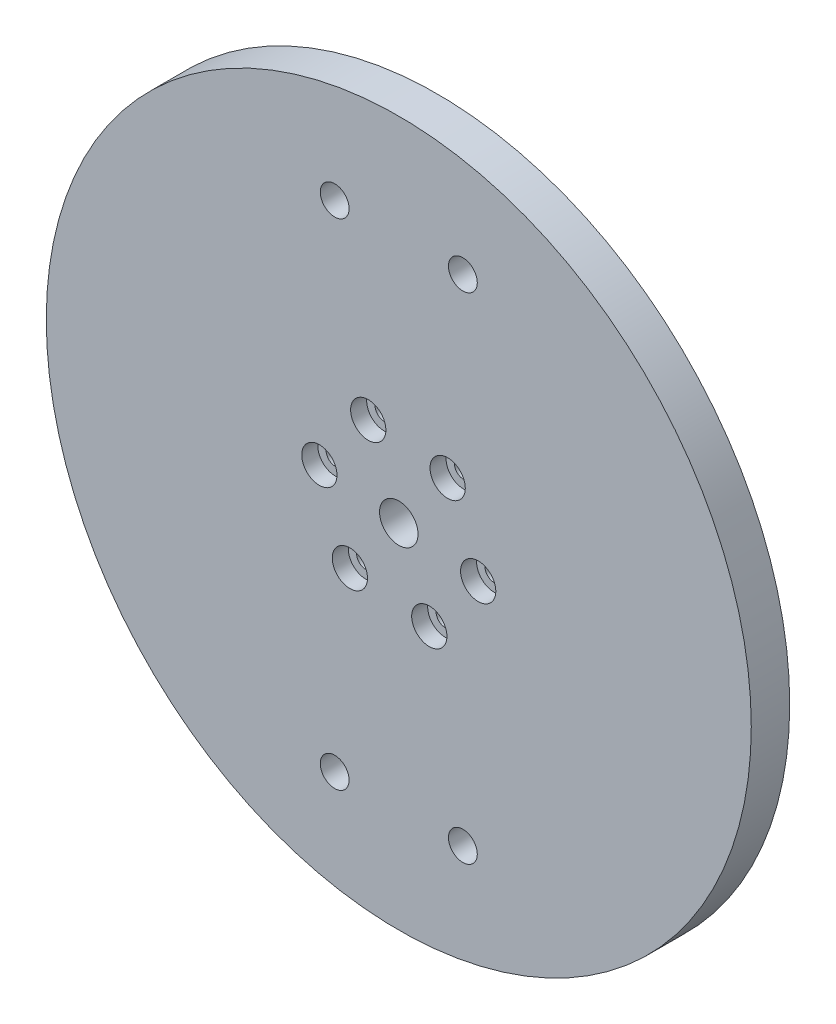
from build123d import *

# Parameters (mm, degrees)
DISCO_START                  = 420
SK_DISCO_R                   = 55
DISCO_DEPTH                  = 6
PASANTES_M2_5_ROTOR_J4_START = 420
SK_PASANTES_M2_5_ROTOR_J4_R  = 1.45
PASANTES_M2_5_ROTOR_J4_DEPTH = 6
CAJAS_M2_5_START             = 423.5
SK_CAJAS_M2_5_R              = 2.75
CAJAS_M2_5_DEPTH             = 2.5
PASO_CABLE_START             = 420
SK_PASO_CABLE_R              = 3
PASO_CABLE_DEPTH             = 6
PASANTES_M4_ANGULOS_START    = 420
SK_PASANTES_M4_ANGULOS_R     = 2.25
PASANTES_M4_ANGULOS_DEPTH    = 6


with BuildPart() as part:
    # Sk_Disco → Disco (new body)
    with BuildSketch(Plane.XY.offset(DISCO_START)):
        Circle(SK_DISCO_R)
    extrude(amount=DISCO_DEPTH)

    # Sk_Pasantes_M2-5_rotor_J4 → Pasantes_M2-5_rotor_J4 (cut)
    with BuildSketch(Plane.XY.offset(PASANTES_M2_5_ROTOR_J4_START)):
        with Locations((12.390194253, -1.653204878)):
            Circle(SK_PASANTES_M2_5_ROTOR_J4_R)
        with Locations((7.626814549, 9.903620542)):
            Circle(SK_PASANTES_M2_5_ROTOR_J4_R)
        with Locations((-4.763379704, 11.55682542)):
            Circle(SK_PASANTES_M2_5_ROTOR_J4_R)
        with Locations((-12.390194253, 1.653204878)):
            Circle(SK_PASANTES_M2_5_ROTOR_J4_R)
        with Locations((-7.626814549, -9.903620542)):
            Circle(SK_PASANTES_M2_5_ROTOR_J4_R)
        with Locations((4.763379704, -11.55682542)):
            Circle(SK_PASANTES_M2_5_ROTOR_J4_R)
    extrude(amount=PASANTES_M2_5_ROTOR_J4_DEPTH, mode=Mode.SUBTRACT)

    # Sk_Cajas_M2-5 → Cajas_M2-5 (cut)
    with BuildSketch(Plane.XY.offset(CAJAS_M2_5_START)):
        with Locations((12.390194253, -1.653204878)):
            Circle(SK_CAJAS_M2_5_R)
        with Locations((7.626814549, 9.903620542)):
            Circle(SK_CAJAS_M2_5_R)
        with Locations((-4.763379704, 11.55682542)):
            Circle(SK_CAJAS_M2_5_R)
        with Locations((-12.390194253, 1.653204878)):
            Circle(SK_CAJAS_M2_5_R)
        with Locations((-7.626814549, -9.903620542)):
            Circle(SK_CAJAS_M2_5_R)
        with Locations((4.763379704, -11.55682542)):
            Circle(SK_CAJAS_M2_5_R)
    extrude(amount=CAJAS_M2_5_DEPTH, mode=Mode.SUBTRACT)

    # Sk_Paso_cable → Paso_cable (cut)
    with BuildSketch(Plane.XY.offset(PASO_CABLE_START)):
        Circle(SK_PASO_CABLE_R)
    extrude(amount=PASO_CABLE_DEPTH, mode=Mode.SUBTRACT)

    # Sk_Pasantes_M4_angulos → Pasantes_M4_angulos (cut)
    with BuildSketch(Plane.XY.offset(PASANTES_M4_ANGULOS_START)):
        with Locations((-10, -38.61)):
            Circle(SK_PASANTES_M4_ANGULOS_R)
        with Locations((-10, 38.61)):
            Circle(SK_PASANTES_M4_ANGULOS_R)
        with Locations((10, -38.61)):
            Circle(SK_PASANTES_M4_ANGULOS_R)
        with Locations((10, 38.61)):
            Circle(SK_PASANTES_M4_ANGULOS_R)
    extrude(amount=PASANTES_M4_ANGULOS_DEPTH, mode=Mode.SUBTRACT)


solid = part.part
